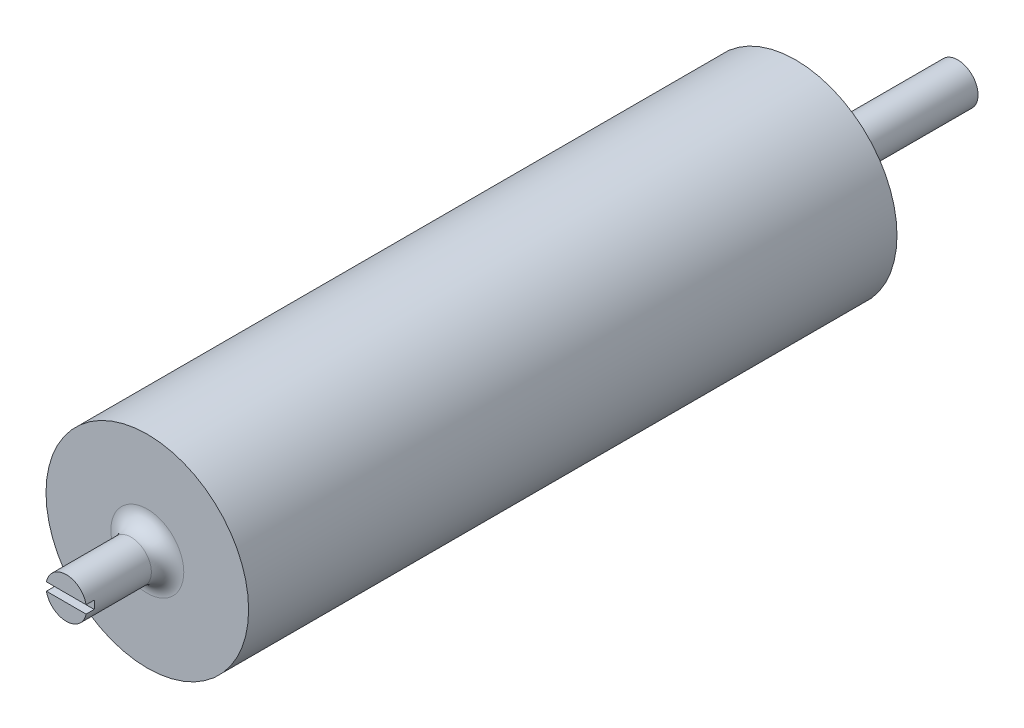
from build123d import *

# Parameters (mm, degrees)
ESQUISSE1_R             = 12.5
BOSS_EXTRU_1_DEPTH      = 80
BOSS_EXTRU_2_DEPTH      = 90
BOSS_EXTRU_2_DEPTH_BACK = 20
ESQUISSE2_R             = 2.5
CONG_1_R                = 2
CONG_2_R                = 2
ENL_V_START             = -5
ESQUISSE3_R             = 0.5
ENL_V_MAT_EXTRU_1_DEPTH = 90
ENL_V_MAT_EXTRU_3_DEPTH = 1


with BuildPart() as part:
    # Esquisse1 → Boss.-Extru.1 (new body)
    with BuildSketch(Plane.XY):
        Circle(ESQUISSE1_R)
    extrude(amount=BOSS_EXTRU_1_DEPTH)

    # Esquisse2 → Boss.-Extru.2 (add, two sides: drawn at the far end of the back side and taken through both)
    with BuildSketch(Plane.XY.offset(-BOSS_EXTRU_2_DEPTH_BACK)):
        with Locations(Location((0, 0, 0), (0, 0, 180))):
            Circle(ESQUISSE2_R)
    extrude(amount=BOSS_EXTRU_2_DEPTH + BOSS_EXTRU_2_DEPTH_BACK)

    # Congé1
    cong_1_edges = [part.edges().sort_by_distance(p)[0] for p in [
        (2.5, 0, 80),
    ]]
    fillet(cong_1_edges, radius=CONG_1_R)

    # Congé2
    cong_2_edges = [part.edges().sort_by_distance(p)[0] for p in [
        (2.5, 0, 0),
    ]]
    fillet(cong_2_edges, radius=CONG_2_R)

    # Esquisse3 → Enlèv. mat.-Extru.1 (cut)
    with BuildSketch(Plane.XY.offset(90).offset(ENL_V_START)):
        Circle(ESQUISSE3_R)
    extrude(amount=-ENL_V_MAT_EXTRU_1_DEPTH, mode=Mode.SUBTRACT)

    # Esquisse5 → Enlèv. mat.-Extru.3 (cut)
    with BuildSketch(Plane.XY.offset(90)):
        with BuildLine():
            Line((-2.449489743, -0.5), (2.449489743, -0.5))
            ThreePointArc((2.449489743, -0.5), (2.5, 0), (2.449489743, 0.5))
            Line((2.449489743, 0.5), (-2.449489743, 0.5))
            ThreePointArc((-2.449489743, 0.5), (-2.5, 0), (-2.449489743, -0.5))
        make_face()
    extrude(amount=-ENL_V_MAT_EXTRU_3_DEPTH, mode=Mode.SUBTRACT)


solid = part.part
